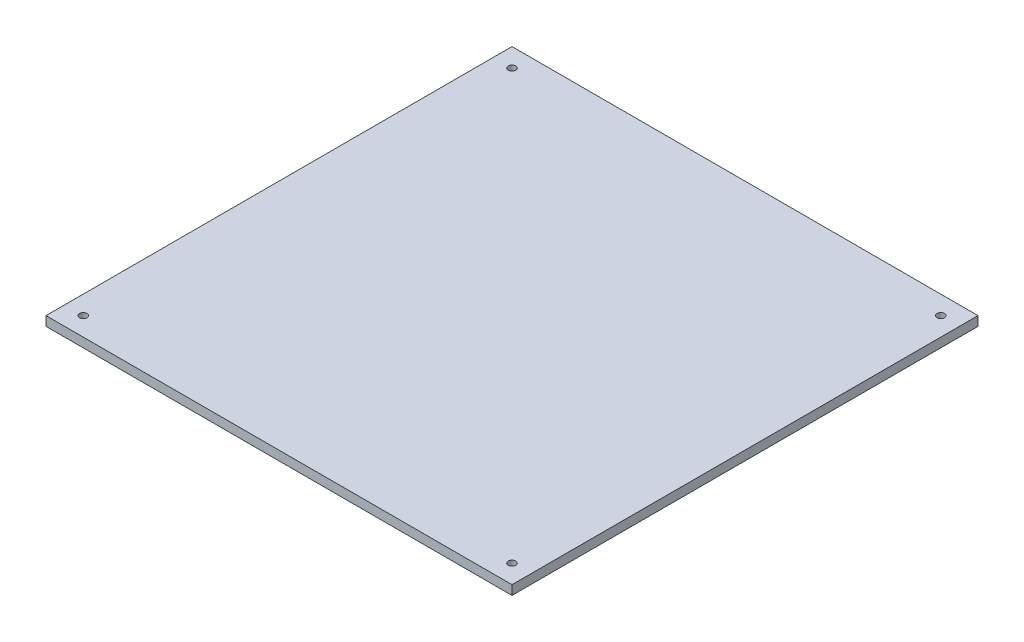
from build123d import *

# Parameters (mm, degrees)
SZKIC1_W                    = 500
SZKIC1_H                    = 500
DODANIE_WYCI_GNI_CIE1_DEPTH = 10
SZKIC2_R                    = 4
WYTNIJ_WYCI_GNI_CIE1_DEPTH  = 354.694783677


with BuildPart() as part:
    # Szkic1 → Dodanie-wyciągnięcie1 (new body)
    with BuildSketch(Plane(origin=(0, 0, 0), x_dir=(1, 0, 0), z_dir=(0, 1, 0))):
        Rectangle(SZKIC1_W, SZKIC1_H)
    extrude(amount=DODANIE_WYCI_GNI_CIE1_DEPTH)

    # Szkic2 → Wytnij-wyciągnięcie1 (cut, through all)
    with BuildSketch(Plane(origin=(0, 10, 0), x_dir=(1, 0, 0), z_dir=(0, 1, 0))):
        with Locations(Location((-230, 230, 0), (0, 0, 270))):
            Circle(SZKIC2_R)
        with Locations(Location((230, 230, 0), (0, 0, 270))):
            Circle(SZKIC2_R)
        with Locations(Location((230, -230, 0), (0, 0, 270))):
            Circle(SZKIC2_R)
        with Locations(Location((-230, -230, 0), (0, 0, 270))):
            Circle(SZKIC2_R)
    extrude(amount=-WYTNIJ_WYCI_GNI_CIE1_DEPTH, mode=Mode.SUBTRACT)


solid = part.part
